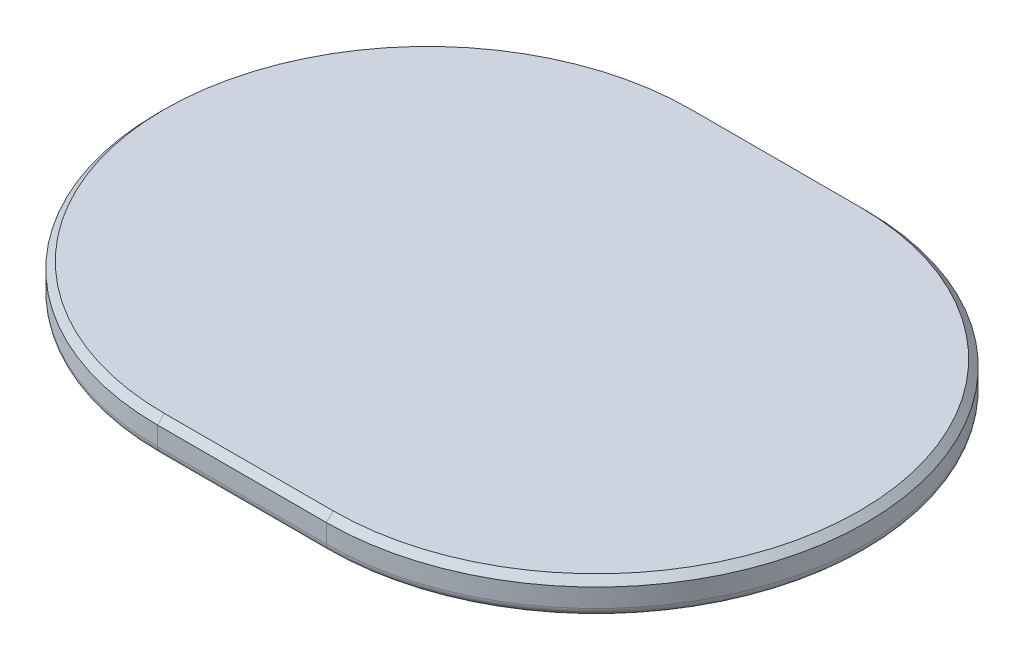
from build123d import *

# Parameters (mm, degrees)
BOSS_EXTRUDE1_DEPTH = 4
CHAMFER1_SIZE       = 0.8
FILLET1_R           = 1


with BuildPart() as part:
    # Sketch1 → Boss-Extrude1 (new body)
    with BuildSketch(Plane(origin=(0, 0, 0), x_dir=(1, 0, 0), z_dir=(0, 1, 0))):
        with BuildLine():
            Line((-10, 32), (10, 32))
            ThreePointArc((10, 32), (42, 0), (10, -32))
            Line((10, -32), (-10, -32))
            ThreePointArc((-10, -32), (-42, 0), (-10, 32))
        make_face()
    extrude(amount=BOSS_EXTRUDE1_DEPTH)

    # Chamfer1
    chamfer1_edges = [part.edges().sort_by_distance(p)[0] for p in [
        (42, 4, 0),
        (0, 4, -32),
        (-42, 4, 0),
        (0, 4, 32),
    ]]
    chamfer(chamfer1_edges, length=CHAMFER1_SIZE)

    # Fillet1
    fillet1_edges = [part.edges().sort_by_distance(p)[0] for p in [
        (0, 0, -32),
        (42, 0, 0),
        (0, 0, 32),
        (-42, 0, 0),
    ]]
    fillet(fillet1_edges, radius=FILLET1_R)


solid = part.part
